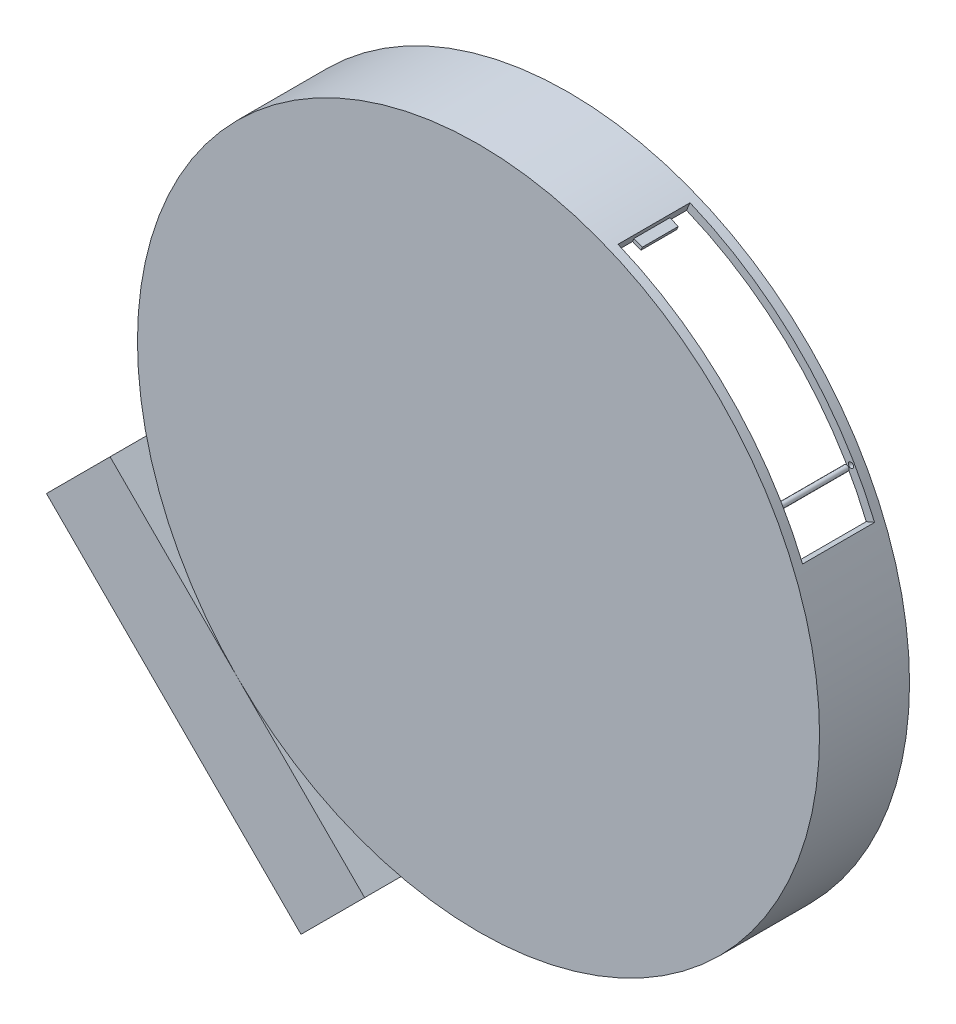
from build123d import *

# Parameters (mm, degrees)
BOSS_EXTRU_1_DEPTH       = 100
ESQUISSE1_R              = 379
BOSS_EXTRU_1_2_DEPTH     = 100
COQUE3_T                 = -10
ENL_V_MAT_EXTRU_4_DEPTH  = 80
BOSS_EXTRU_3_DEPTH       = 85
BOSS_EXTRU_3_DEPTH_BACK  = 5
ESQUISSE5_R              = 3
ESQUISSE7_R              = 3
ENL_V_MAT_EXTRU_12_DEPTH = 15
BOSS_EXTRU_27_DEPTH      = 10


with BuildPart() as part:
    # Esquisse1 → Boss.-Extru.1 (new body)
    with BuildSketch(Plane.XY):
        Polygon((-126.572113832, -409.414826307), (-267.99347007, -267.99347007), (-409.414826307, -126.572113832), (-480.125504426, -197.282791951), (-197.282791951, -480.125504426), align=None)
    extrude(amount=BOSS_EXTRU_1_DEPTH)


with BuildPart() as body_2:
    # Esquisse1 → Boss.-Extru.1 2 (new body)
    with BuildSketch(Plane.XY):
        Circle(ESQUISSE1_R)
    extrude(amount=BOSS_EXTRU_1_2_DEPTH)

    # Coque3
    coque3_openings = [body_2.faces().sort_by_distance(p)[0] for p in [
        (0, 0, 0),
    ]]
    offset(amount=COQUE3_T, openings=coque3_openings, kind=Kind.INTERSECTION)

    # Esquisse3 → Enlèv. mat.-Extru.4 (cut)
    with BuildSketch(Plane(origin=(0, 0, 90), x_dir=(-1, 0, 0), z_dir=(0, 0, -1))):
        with BuildLine():
            Line((-350.150342822, 145.037020866), (0, 0))
            Line((0, 0), (-145.037020866, 350.150342822))
            ThreePointArc((-145.037020866, 350.150342822), (-210.561118314, 315.126983063), (-267.99347007, 267.99347007))
            ThreePointArc((-267.99347007, 267.99347007), (-315.126983063, 210.561118314), (-350.150342822, 145.037020866))
        make_face()
    extrude(amount=ENL_V_MAT_EXTRU_4_DEPTH, mode=Mode.SUBTRACT)

    # Esquisse5 → Boss.-Extru.3 (add, two sides: drawn at the far end of the back side and taken through both)
    with BuildSketch(Plane(origin=(0, 0, 90), x_dir=(-1, 0, 0), z_dir=(0, 0, -1)).offset(-BOSS_EXTRU_3_DEPTH_BACK)):
        with Locations(Location((-323.893501015, 187, 0), (0, 0, 180))):
            Circle(ESQUISSE5_R)
    extrude(amount=BOSS_EXTRU_3_DEPTH + BOSS_EXTRU_3_DEPTH_BACK)

    # Esquisse7 → Enlèv. mat.-Extru.12 (cut)
    with BuildSketch(Plane(origin=(0, 0, 0), x_dir=(-1, 0, 0), z_dir=(0, 0, -1))):
        with Locations((-323.893501015, 187)):
            Circle(ESQUISSE7_R)
    extrude(amount=-ENL_V_MAT_EXTRU_12_DEPTH, mode=Mode.SUBTRACT)

    # Esquisse12 → Boss.-Extru.27 (add)
    with BuildSketch(Plane(origin=(0, 0, 0), x_dir=(0, 0, -1), z_dir=(0.9238795325112816, -0.3826834323651025, 0))):
        Polygon((-70, 373), (-70, 369), (-50, 369), (-30, 369), (-30, 373), align=None)
    extrude(amount=BOSS_EXTRU_27_DEPTH)


solid = Compound([part.part, body_2.part])
